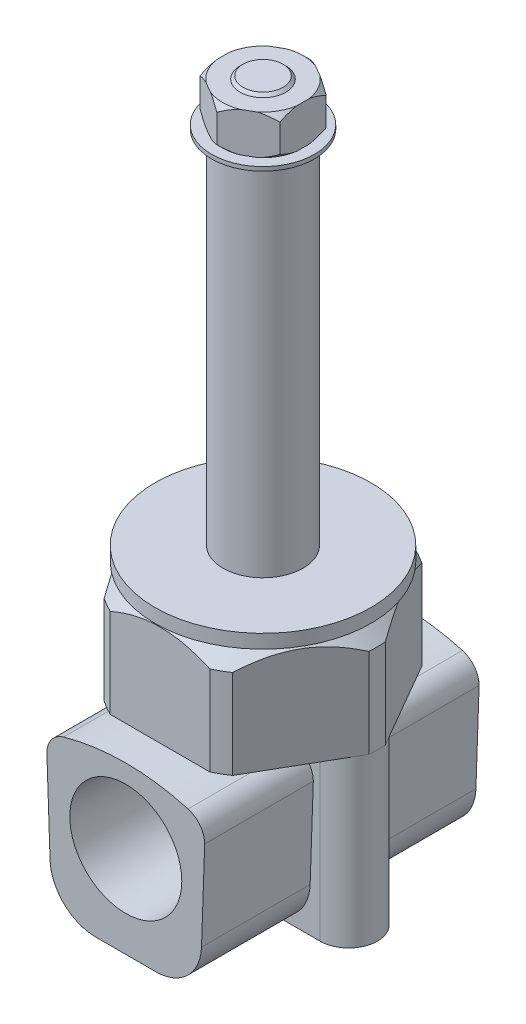
from build123d import *

# Parameters (mm, degrees)
BASE_NUT_EXTRUDE_DEPTH       = 9.3
SKETCH3_R                    = 9.45
COIL_BASE_DEPTH              = 1.2
SKETCH4_R                    = 3.5
INNER_CYLINDER_DEPTH         = 31.5
SKETCH5_R                    = 4.5
WASHER_DEPTH                 = 0.35
SKETCH6_R                    = 2
MOUNTING_THREAD_DEPTH        = 3.7
THREAD_CHAMFER_SIZE          = 0.25
PORT_BASE_DEPTH              = 14.5
IN_PORT_BODY_DEPTH           = 9.5
OUT_PORT_BODY_DEPTH          = 9.5
M3_MOUNTING_HOLES_AT_2_COUNT = 2
M3_MOUNTING_HOLES_AT_2_PITCH = 15
SKETCH21_R                   = 2
HEX_NUT_DEPTH                = 3.45


with BuildPart() as part:
    # Sketch1 → Base Nut Extrude (new body)
    with BuildSketch(Plane(origin=(0, 0, 0), x_dir=(1, 0, 0), z_dir=(0, 1, 0))):
        with BuildLine():
            Line((-9.973678106, -0.725082782), (-5.614779162, -8.274917218))
            ThreePointArc((-5.614779162, -8.274917218), (-5, -8.660254038), (-4.358898944, -9))
            Line((-4.358898944, -9), (4.358898944, -9))
            ThreePointArc((4.358898944, -9), (5, -8.660254038), (5.614779162, -8.274917218))
            Line((5.614779162, -8.274917218), (9.973678106, -0.725082782))
            ThreePointArc((9.973678106, -0.725082782), (10, 0), (9.973678106, 0.725082782))
            Line((9.973678106, 0.725082782), (5.614779162, 8.274917218))
            ThreePointArc((5.614779162, 8.274917218), (5, 8.660254038), (4.358898944, 9))
            Line((4.358898944, 9), (-4.358898944, 9))
            ThreePointArc((-4.358898944, 9), (-5, 8.660254038), (-5.614779162, 8.274917218))
            Line((-5.614779162, 8.274917218), (-9.973678106, 0.725082782))
            ThreePointArc((-9.973678106, 0.725082782), (-10, 0), (-9.973678106, -0.725082782))
        make_face()
    extrude(amount=BASE_NUT_EXTRUDE_DEPTH)

    # Sketch2 → Nut Detail (revolve, cut)
    with BuildSketch(Plane.XY, mode=Mode.PRIVATE) as nut_detail_sk:
        Polygon((-9.973678106, 9.3), (-8.5, 9.3), (-10, 7.8), (-10, 9.3), align=None)
    revolve(nut_detail_sk.sketch.rotate(Axis((0, 49.0775, 0), (0, -1, 0)), 115.841932763), axis=Axis((0, 49.0775, 0), (0, -1, 0)), mode=Mode.SUBTRACT)

    # Sketch3 → Coil Base (add)
    with BuildSketch(Plane(origin=(0, 9.3, 0), x_dir=(1, 0, 0), z_dir=(0, 1, 0))):
        with Locations(Location((0, 0, 0), (0, 0, 270))):
            Circle(SKETCH3_R)
    extrude(amount=COIL_BASE_DEPTH)

    # Sketch4 → Inner Cylinder (add)
    with BuildSketch(Plane(origin=(0, 10.5, 0), x_dir=(1, 0, 0), z_dir=(0, 1, 0))):
        with Locations(Location((0, 0, 0), (0, 0, 270))):
            Circle(SKETCH4_R)
    extrude(amount=INNER_CYLINDER_DEPTH)

    # Sketch5 → Washer (add)
    with BuildSketch(Plane(origin=(0, 42, 0), x_dir=(1, 0, 0), z_dir=(0, 1, 0))):
        with Locations(Location((0, 0, 0), (0, 0, 270))):
            Circle(SKETCH5_R)
    extrude(amount=WASHER_DEPTH)

    # Sketch6 → Mounting Thread (add)
    with BuildSketch(Plane(origin=(0, 42.35, 0), x_dir=(1, 0, 0), z_dir=(0, 1, 0))):
        with Locations(Location((0, 0, 0), (0, 0, 270))):
            Circle(SKETCH6_R)
    extrude(amount=MOUNTING_THREAD_DEPTH)

    # Thread Chamfer
    thread_chamfer_edges = [part.edges().sort_by_distance(p)[0] for p in [
        (0, 46.05, -2),
    ]]
    chamfer(thread_chamfer_edges, length=THREAD_CHAMFER_SIZE)

    # Sketch7 → Port Base (add)
    with BuildSketch(Plane.XZ):
        with BuildLine():
            Line((-7.5, 2.5), (7.5, 2.5))
            ThreePointArc((7.5, 2.5), (10, 0), (7.5, -2.5))
            Line((7.5, -2.5), (-7.5, -2.5))
            ThreePointArc((-7.5, -2.5), (-10, 0), (-7.5, 2.5))
        make_face()
    extrude(amount=PORT_BASE_DEPTH)


with BuildPart() as body_2:
    # Sketch8 → In Port Body (new body)
    with BuildSketch(Plane.XY.offset(2.5)):
        with BuildLine():
            Line((-6.9, -2.679780602), (-6.622037052, -10.639597987))
            ThreePointArc((-6.622037052, -10.639597987), (-5.403107226, -13.377359201), (-2.624473744, -14.5))
            Line((-2.624473744, -14.5), (2.624473744, -14.5))
            ThreePointArc((2.624473744, -14.5), (5.403107226, -13.377359201), (6.622037052, -10.639597987))
            Line((6.622037052, -10.639597987), (6.9, -2.679780602))
            ThreePointArc((6.9, -2.679780602), (6.495131482, -1.47331653), (5.444444444, -0.75531178))
            ThreePointArc((5.444444444, -0.75531178), (0, 0), (-5.444444444, -0.75531178))
            ThreePointArc((-5.444444444, -0.75531178), (-6.495131482, -1.47331653), (-6.9, -2.679780602))
        make_face()
    extrude(amount=IN_PORT_BODY_DEPTH)

    # Sketch10 → 1/8 Rc In Port (revolve, cut)
    with BuildSketch(Plane(origin=(0, -6.5, 12), x_dir=(0, -1, 0), z_dir=(1, 0, 0))):
        Polygon((0, 0), (0, 9), (3.95, 9), (3.95, 8.5), (4.632997221, 8.5), (4.8983385, 0), align=None)
    revolve(axis=Axis((0, -6.5, 18.35), (0, 0, -1)), mode=Mode.SUBTRACT)


with BuildPart() as body_3:
    # Sketch9 → Out Port Body (new body)
    with BuildSketch(Plane(origin=(0, 0, -2.5), x_dir=(-1, 0, 0), z_dir=(0, 0, -1))):
        with BuildLine():
            Line((6.9, -2.679780602), (6.622037052, -10.639597987))
            ThreePointArc((6.622037052, -10.639597987), (5.403107226, -13.377359201), (2.624473744, -14.5))
            Line((2.624473744, -14.5), (-2.624473744, -14.5))
            ThreePointArc((-2.624473744, -14.5), (-5.403107226, -13.377359201), (-6.622037052, -10.639597987))
            Line((-6.622037052, -10.639597987), (-6.9, -2.679780602))
            ThreePointArc((-6.9, -2.679780602), (-6.495131482, -1.47331653), (-5.444444444, -0.75531178))
            ThreePointArc((-5.444444444, -0.75531178), (0, 0), (5.444444444, -0.75531178))
            ThreePointArc((5.444444444, -0.75531178), (6.495131482, -1.47331653), (6.9, -2.679780602))
        make_face()
    extrude(amount=OUT_PORT_BODY_DEPTH)


with BuildPart() as f_1_8_rc_out_port_tool:
    # Sketch12 → 1/8 Rc Out Port (revolve)
    with BuildSketch(Plane(origin=(0, -6.5, -12), x_dir=(0, 1, 0), z_dir=(1, 0, 0))):
        Polygon((0, 0), (0, 12.873399445), (3.95, 10.5), (3.95, 7.4), (4.632997004, 7.4), (4.864, 0), align=None)
    revolve(axis=Axis((0, -6.5, -18.35), (0, 0, 1)))


with BuildPart() as part_1:
    add(part.part)

    # 1/8 Rc Out Port: cut by f_1_8_rc_out_port_tool
    add(f_1_8_rc_out_port_tool.part, mode=Mode.SUBTRACT)

    # Sketch14 → M3 Mounting Holes (revolve, cut)
    with BuildSketch(Plane(origin=(7.5, -14.5, 0), x_dir=(0, 0, -1), z_dir=(1, 0, 0))):
        Polygon((0, 0), (0, 5.751075774), (1.25, 5), (1.25, 0), align=None)
    m3_mounting_holes = revolve(axis=Axis((7.5, -20.85, 0), (0, 1, 0)), mode=Mode.SUBTRACT)

    # M3 Mounting Holes at 2: M3 Mounting Holes ×2
    with Locations(*[(-i * M3_MOUNTING_HOLES_AT_2_PITCH, 0, 0) for i in range(1, M3_MOUNTING_HOLES_AT_2_COUNT)]):
        add(m3_mounting_holes, mode=Mode.SUBTRACT)

    # Sketch21 → Hex Nut (add)
    with BuildSketch(Plane(origin=(0, 42.35, 0), x_dir=(1, 0, 0), z_dir=(0, 1, 0))):
        Polygon((-3.5, 2.020725942), (-3.5, -2.020725942), (0, -4.041451884), (3.5, -2.020725942), (3.5, 2.020725942), (0, 4.041451884), align=None)
        Circle(SKETCH21_R, mode=Mode.SUBTRACT)
    extrude(amount=HEX_NUT_DEPTH)

    # Sketch23 → Hex Nut Detail (revolve, cut)
    with BuildSketch(Plane(origin=(0, 0, 0), x_dir=(0, 0, -1), z_dir=(1, 0, 0))):
        Polygon((-4.041451884, 42.35), (-3.541451884, 42.35), (-4.041451884, 42.85), align=None)
        Polygon((-4.041451884, 45.8), (-3.541451884, 45.8), (-4.041451884, 45.3), align=None)
    revolve(axis=Axis((0, 49.0775, 0), (0, -1, 0)), mode=Mode.SUBTRACT)


with BuildPart() as body_3_1:
    add(body_3.part)

    # 1/8 Rc Out Port: cut by f_1_8_rc_out_port_tool
    add(f_1_8_rc_out_port_tool.part, mode=Mode.SUBTRACT)


solid = Compound([body_2.part, part_1.part, body_3_1.part])
